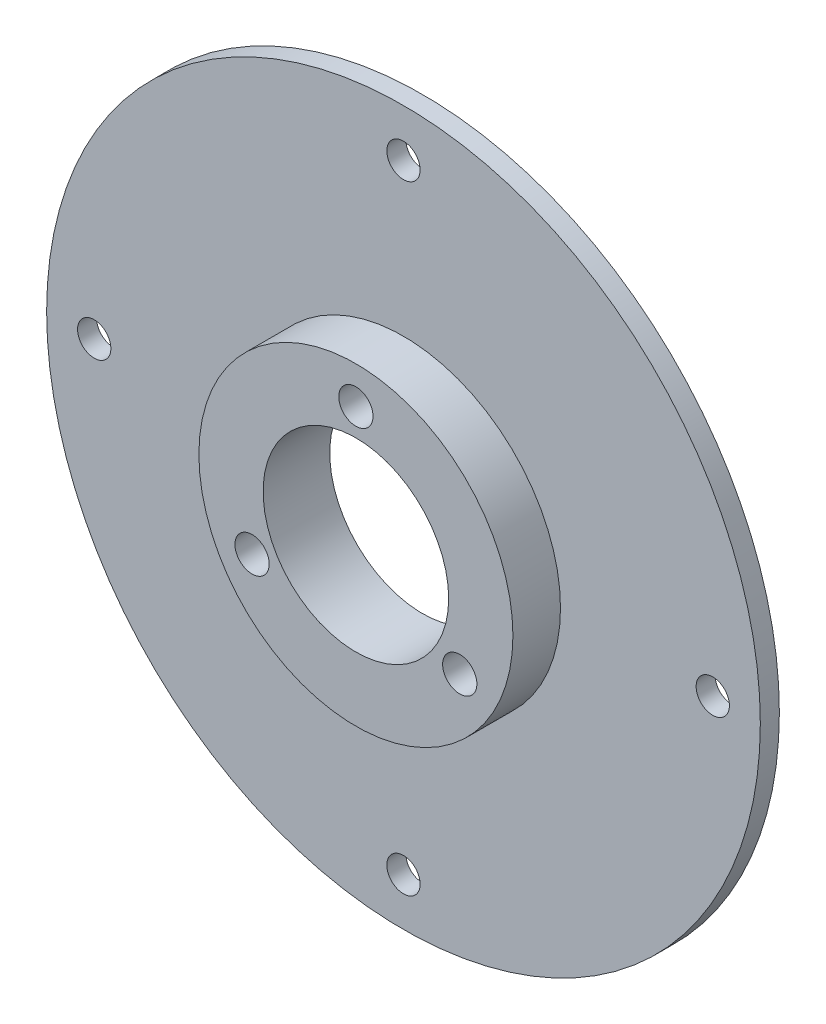
from build123d import *

# Parameters (mm, degrees)
SKETCH_1_R          = 37.5
EXTRUDE_1_DEPTH     = 2
SKETCH_2_R          = 1.75
CUT_EXTRUDE_1_DEPTH = 2
SKETCH_3_R          = 16.5
EXTRUDE_2_DEPTH     = 5
SKETCH_4_R          = 9.75
SKETCH_4_R_2        = 1.8
CUT_EXTRUDE_2_DEPTH = 7


with BuildPart() as part:
    # Эскиз1 → Бобышка-Вытянуть1 (new body)
    with BuildSketch(Plane.XY):
        Circle(SKETCH_1_R)
    extrude(amount=EXTRUDE_1_DEPTH)

    # Эскиз2 → Вырез-Вытянуть1 (cut)
    with BuildSketch(Plane.XY.offset(2)):
        with Locations((0, 32.5)):
            Circle(SKETCH_2_R)
        with Locations((32.5, 0)):
            Circle(SKETCH_2_R)
        with Locations((0, -32.5)):
            Circle(SKETCH_2_R)
        with Locations((-32.5, 0)):
            Circle(SKETCH_2_R)
    extrude(amount=-CUT_EXTRUDE_1_DEPTH, mode=Mode.SUBTRACT)

    # Эскиз3 → Бобышка-Вытянуть2 (add)
    with BuildSketch(Plane.XY.offset(2)):
        Circle(SKETCH_3_R)
    extrude(amount=EXTRUDE_2_DEPTH)

    # Эскиз4 → Вырез-Вытянуть2 (cut)
    with BuildSketch(Plane.XY.offset(7)):
        Circle(SKETCH_4_R)
        with Locations((0, 12.6)):
            Circle(SKETCH_4_R_2)
        with Locations((10.911920088, -6.3)):
            Circle(SKETCH_4_R_2)
        with Locations((-10.911920088, -6.3)):
            Circle(SKETCH_4_R_2)
    extrude(amount=-CUT_EXTRUDE_2_DEPTH, mode=Mode.SUBTRACT)


solid = part.part
